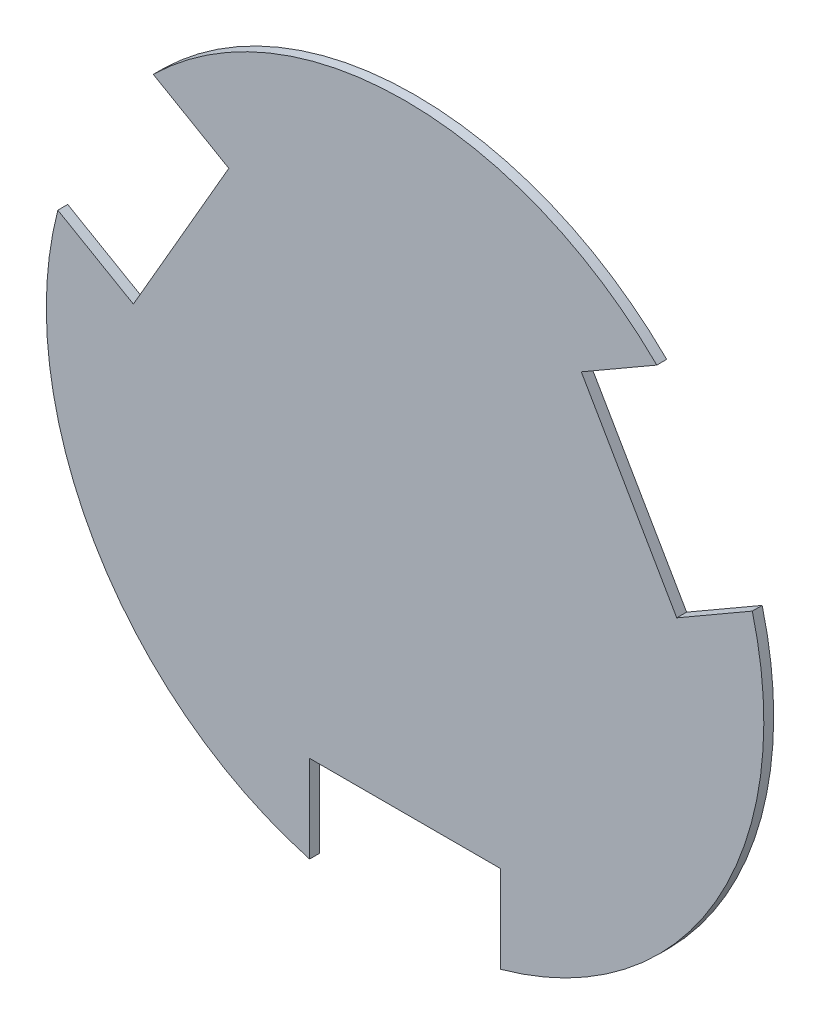
from build123d import *

# Parameters (mm, degrees)
ESQUISSE2_R             = 109
BOSS_EXTRU_1_DEPTH      = 3
ESQUISSE3_W             = 58
ESQUISSE3_H             = 42.41769301
ENL_V_MAT_EXTRU_1_DEPTH = 3


with BuildPart() as part:
    # Esquisse2 → Boss.-Extru.1 (new body)
    with BuildSketch(Plane.XY):
        Circle(ESQUISSE2_R)
    extrude(amount=BOSS_EXTRU_1_DEPTH)

    # Esquisse3 → Enlèv. mat.-Extru.1 (cut)
    with BuildSketch(Plane.XY.offset(3)):
        with Locations((0, -99.780250798)):
            Rectangle(ESQUISSE3_W, ESQUISSE3_H)
        Polygon((-90.279631846, 85.609285361), (-119.279631846, 35.379811942), (-82.544832128, 14.170965437), (-53.544832128, 64.400438856), align=None)
        Polygon((119.279631846, 35.379811942), (90.279631846, 85.609285361), (53.544832128, 64.400438856), (82.544832128, 14.170965437), align=None)
    extrude(amount=-ENL_V_MAT_EXTRU_1_DEPTH, mode=Mode.SUBTRACT)


solid = part.part
